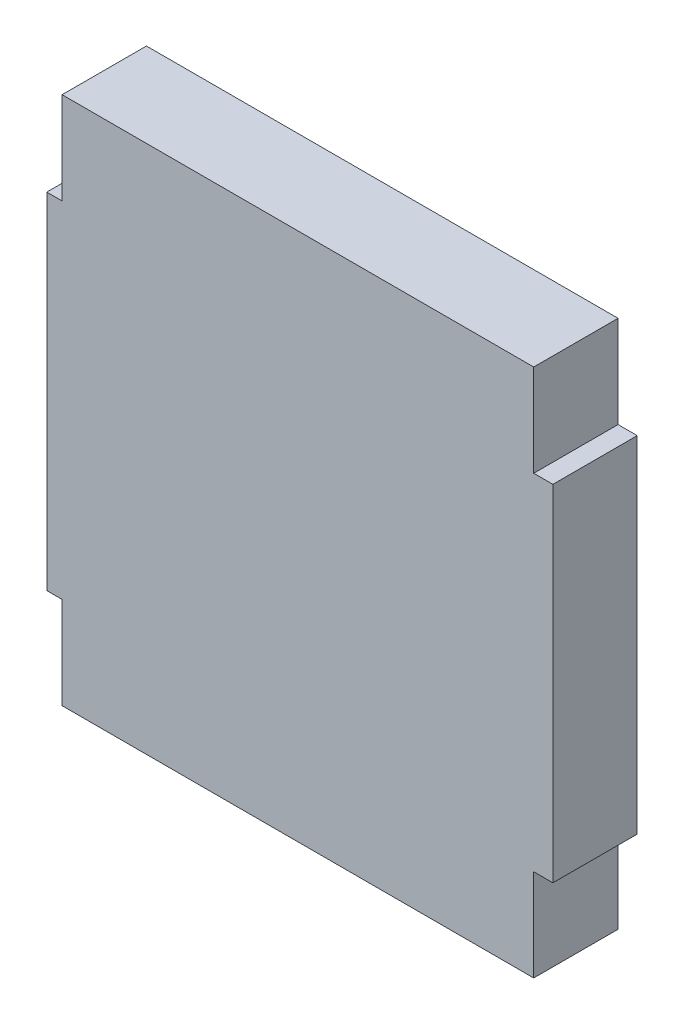
from build123d import *

# Parameters (mm, degrees)
COMPONENT_OUTLINE_DEPTH = 1.1


with BuildPart() as part:
    # 草图1 → Component_Outline (new body)
    with BuildSketch(Plane.XY):
        Polygon((-3.275, -2.25), (-3.075, -2.25), (-3.075, -3.45), (3.075, -3.45), (3.075, -2.25), (3.325, -2.25), (3.325, 2.25), (3.075, 2.25), (3.075, 3.45), (-3.075, 3.45), (-3.075, 2.25), (-3.2, 2.25), (-3.275, 2.25), align=None)
    extrude(amount=COMPONENT_OUTLINE_DEPTH)


solid = part.part
